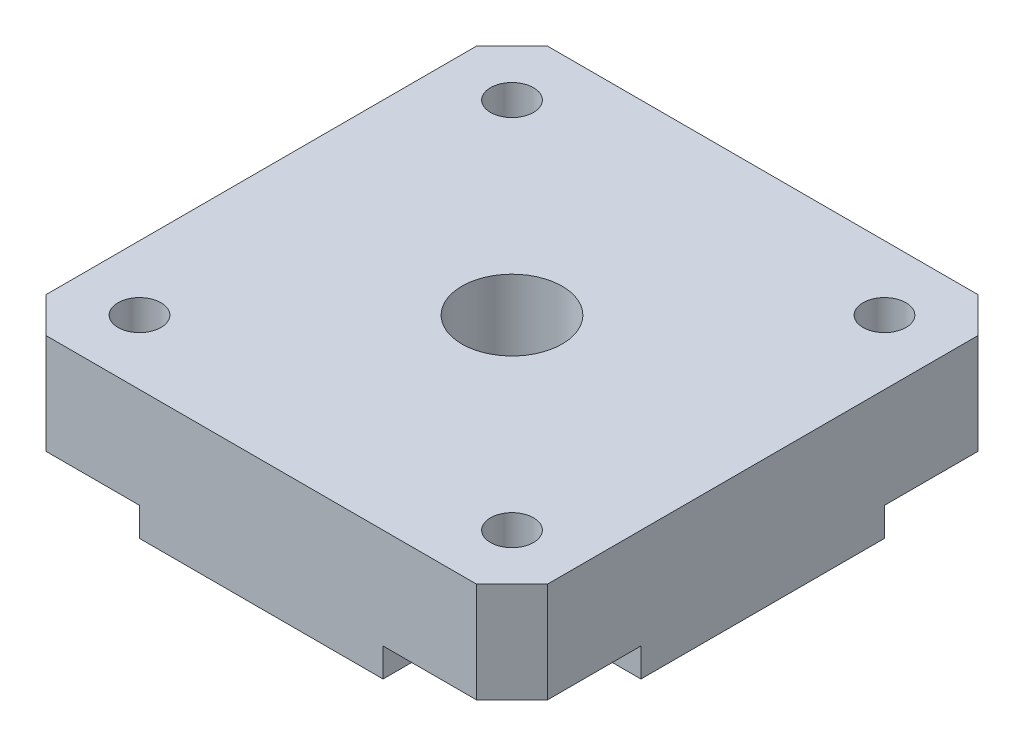
from build123d import *

# Parameters (mm, degrees)
SALIENTE_EXTRUIR1_DEPTH = 9
CROQUIS2_R              = 3.5
CORTAR_EXTRUIR1_DEPTH   = 51.309044912
CROQUIS3_R              = 1.5
CORTAR_EXTRUIR2_DEPTH   = 51.309044912
CUT_EXTRUDE1_DEPTH      = 2


with BuildPart() as part:
    # Croquis1 → Saliente-Extruir1 (new body)
    with BuildSketch(Plane(origin=(0, 0, 0), x_dir=(1, 0, 0), z_dir=(0, 1, 0))):
        Polygon((0, 2.473088065), (2.473088065, 0), (32.526911935, 0), (35, 2.473088065), (35, 32.526911935), (32.526911935, 35), (2.473088065, 35), (0, 32.526911935), align=None)
    extrude(amount=SALIENTE_EXTRUIR1_DEPTH)

    # Croquis2 → Cortar-Extruir1 (cut, through all)
    with BuildSketch(Plane(origin=(0, 9, 0), x_dir=(1, 0, 0), z_dir=(0, 1, 0))):
        with Locations(Location((17.5, 17.5, 0), (0, 0, 270))):
            Circle(CROQUIS2_R)
    extrude(amount=-CORTAR_EXTRUIR1_DEPTH, mode=Mode.SUBTRACT)

    # Croquis3 → Cortar-Extruir2 (cut, through all)
    with BuildSketch(Plane(origin=(0, 9, 0), x_dir=(1, 0, 0), z_dir=(0, 1, 0))):
        with Locations(Location((4.5, 30.5, 0), (0, 0, 270))):
            Circle(CROQUIS3_R)
        with Locations(Location((30.5, 30.5, 0), (0, 0, 270))):
            Circle(CROQUIS3_R)
        with Locations(Location((30.5, 4.5, 0), (0, 0, 270))):
            Circle(CROQUIS3_R)
        with Locations(Location((4.5, 4.5, 0), (0, 0, 270))):
            Circle(CROQUIS3_R)
    extrude(amount=-CORTAR_EXTRUIR2_DEPTH, mode=Mode.SUBTRACT)

    # Sketch1 → Cut-Extrude1 (cut)
    with BuildSketch(Plane.XZ):
        with BuildLine():
            Line((35, 0), (35, -9))
            Line((35, -9), (30, -9))
            ThreePointArc((30, -9), (27.171572875, -7.828427125), (26, -5))
            Line((26, -5), (26, 0))
            Line((26, 0), (35, 0))
        make_face()
        with BuildLine():
            Line((0, 0), (9, 0))
            Line((9, 0), (9, -5))
            ThreePointArc((9, -5), (7.828427125, -7.828427125), (5, -9))
            Line((5, -9), (0, -9))
            Line((0, -9), (0, 0))
        make_face()
        with BuildLine():
            Line((35, -35), (26, -35))
            Line((26, -35), (26, -30))
            ThreePointArc((26, -30), (27.171572875, -27.171572875), (30, -26))
            Line((30, -26), (35, -26))
            Line((35, -26), (35, -35))
        make_face()
        with BuildLine():
            Line((0, -35), (0, -26))
            Line((0, -26), (5, -26))
            ThreePointArc((5, -26), (7.828427125, -27.171572875), (9, -30))
            Line((9, -30), (9, -35))
            Line((9, -35), (0, -35))
        make_face()
    extrude(amount=-CUT_EXTRUDE1_DEPTH, mode=Mode.SUBTRACT)


solid = part.part
